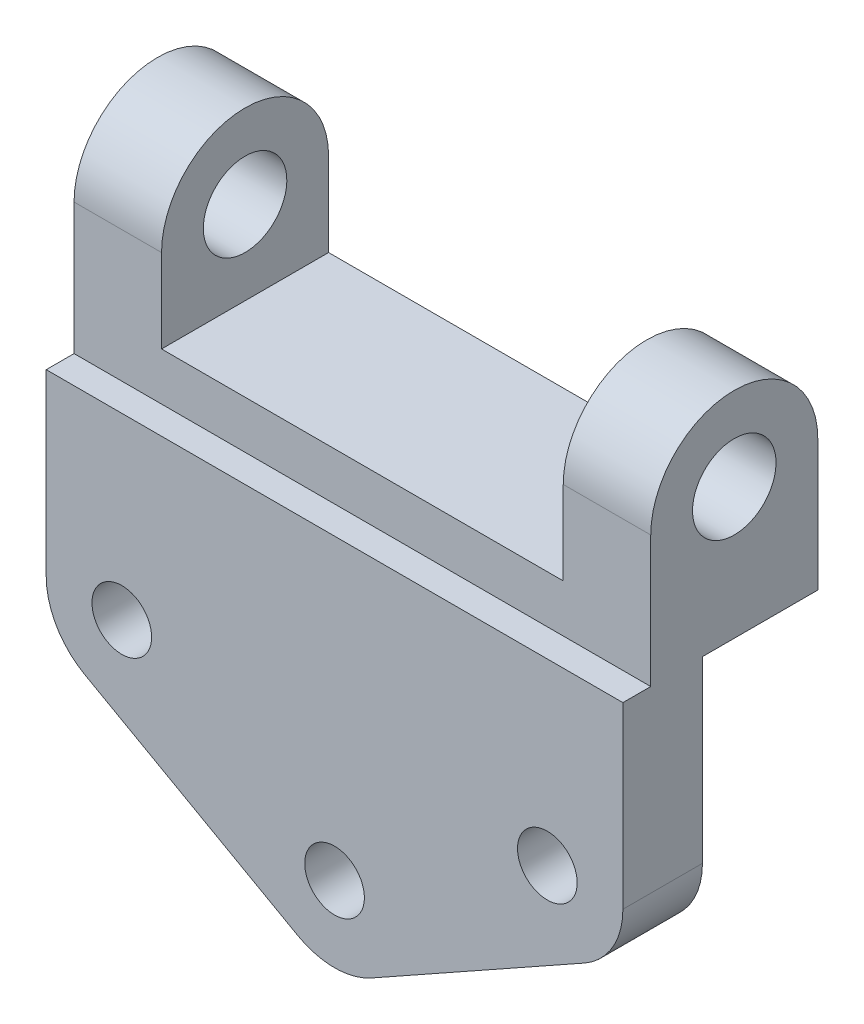
from build123d import *

# Parameters (mm, degrees)
SKETCH1_R           = 7.5
BOSS_EXTRUDE1_DEPTH = 20
BOSS_EXTRUDE2_START = -29
BOSS_EXTRUDE2_DEPTH = 42
SKETCH2_R           = 10.5
CUT_EXTRUDE1_DEPTH  = 146


with BuildPart() as part:
    # Sketch1 → Boss-Extrude1 (new body)
    with BuildSketch(Plane.XY):
        with BuildLine():
            Line((-72.5, 0), (-72.5, -45))
            ThreePointArc((-72.5, -45), (-69.894587599, -54.602994193), (-62.792895003, -61.572329422))
            Line((-62.792895003, -61.572329422), (-9.292895003, -91.572329422))
            ThreePointArc((-9.292895003, -91.572329422), (0, -94), (9.292895003, -91.572329422))
            Line((9.292895003, -91.572329422), (62.792895003, -61.572329422))
            ThreePointArc((62.792895003, -61.572329422), (69.894587599, -54.602994193), (72.5, -45))
            Line((72.5, -45), (72.5, 0))
            Line((72.5, 0), (-72.5, 0))
        make_face()
        with Locations((0, -75)):
            Circle(SKETCH1_R, mode=Mode.SUBTRACT)
        with Locations((-53.5, -45)):
            Circle(SKETCH1_R, mode=Mode.SUBTRACT)
        with Locations((53.5, -45)):
            Circle(SKETCH1_R, mode=Mode.SUBTRACT)
    extrude(amount=BOSS_EXTRUDE1_DEPTH)

    # Sketch1<3> → Boss-Extrude2 (add)
    with BuildSketch(Plane.XY.offset(BOSS_EXTRUDE2_START)):
        Polygon((-72.5, 54), (-72.5, 0), (72.5, 0), (72.5, 54), (50.5, 54), (50.5, 12), (-50.5, 12), (-50.5, 54), align=None)
    extrude(amount=BOSS_EXTRUDE2_DEPTH)

    # Sketch2 → Cut-Extrude1 (cut)
    with BuildSketch(Plane(origin=(72.5, 0, 0), x_dir=(0, 0, -1), z_dir=(1, 0, 0))):
        with Locations((8, 33)):
            Circle(SKETCH2_R)
        with BuildLine():
            ThreePointArc((8, 54), (22.849242405, 47.849242405), (29, 33))
            Line((29, 33), (29, 54))
            Line((29, 54), (8, 54))
        make_face()
        with BuildLine():
            ThreePointArc((-13, 33), (-6.849242405, 47.849242405), (8, 54))
            Line((8, 54), (-13, 54))
            Line((-13, 54), (-13, 33))
        make_face()
    extrude(amount=-CUT_EXTRUDE1_DEPTH, mode=Mode.SUBTRACT)


solid = part.part
